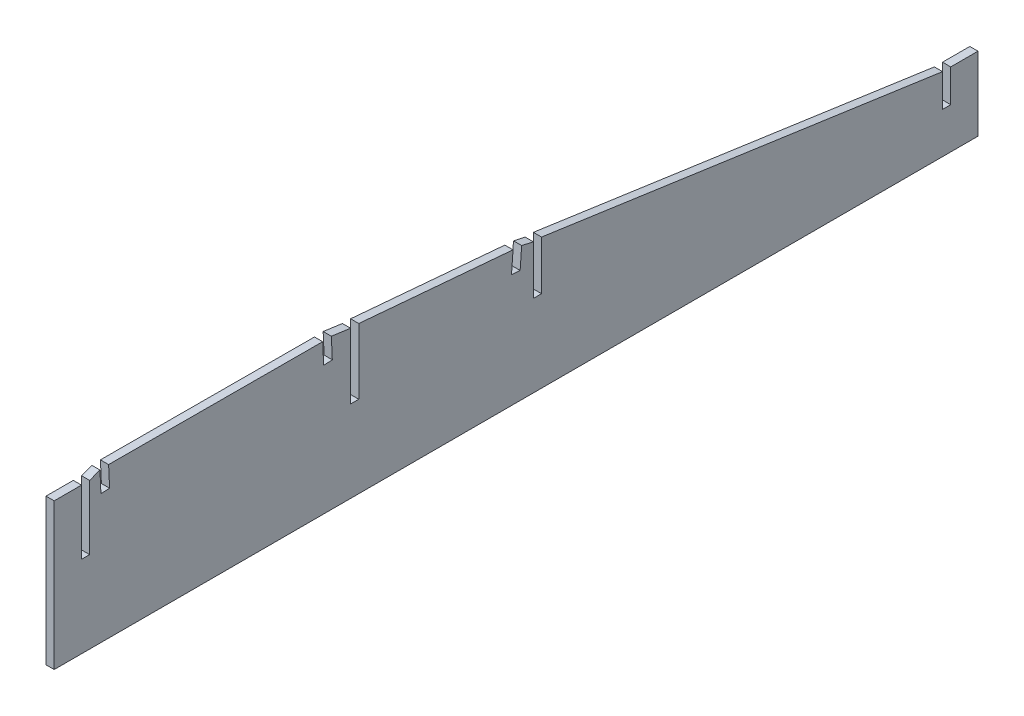
from build123d import *

# Parameters (mm, degrees)
BOSS_EXTRUDE1_DEPTH = 3


with BuildPart() as part:
    # Sketch1 → Boss-Extrude1 (new body)
    with BuildSketch(Plane(origin=(299.875, 0, 0), x_dir=(0, 0, -1), z_dir=(1, 0, 0))):
        Polygon((254.342966202, 46.438825445), (257.342966202, 46.438825445), (257.342966202, 70.005768865), (261.120760322, 71.404391483), (261.478925383, 63.707591635), (264.650493907, 63.855165721), (264.292328864, 71.551965185), (342.771929635, 71.321990196), (343.128897762, 63.650911904), (346.300465699, 63.798498596), (345.943497573, 71.469576862), (353, 70.477223834), (353, 46.438825445), (356, 46.438825445), (356, 70.477223834), (412.547538785, 65.600801419), (411.981466053, 57.979089008), (415.147745162, 57.743926072), (415.71381799, 65.36563978), (420, 64.4233549), (420, 46.438825445), (423, 46.438825445), (423, 64.4233549), (570, 43.443621916), (570, 31.443621916), (573, 31.443621916), (573, 43.443621916), (583, 43.443621916), (583, 16.438825445), (244.342966202, 16.438825445), (244.342966202, 70.005768865), (254.342966202, 70.005768865), align=None)
    extrude(amount=-BOSS_EXTRUDE1_DEPTH)


solid = part.part
